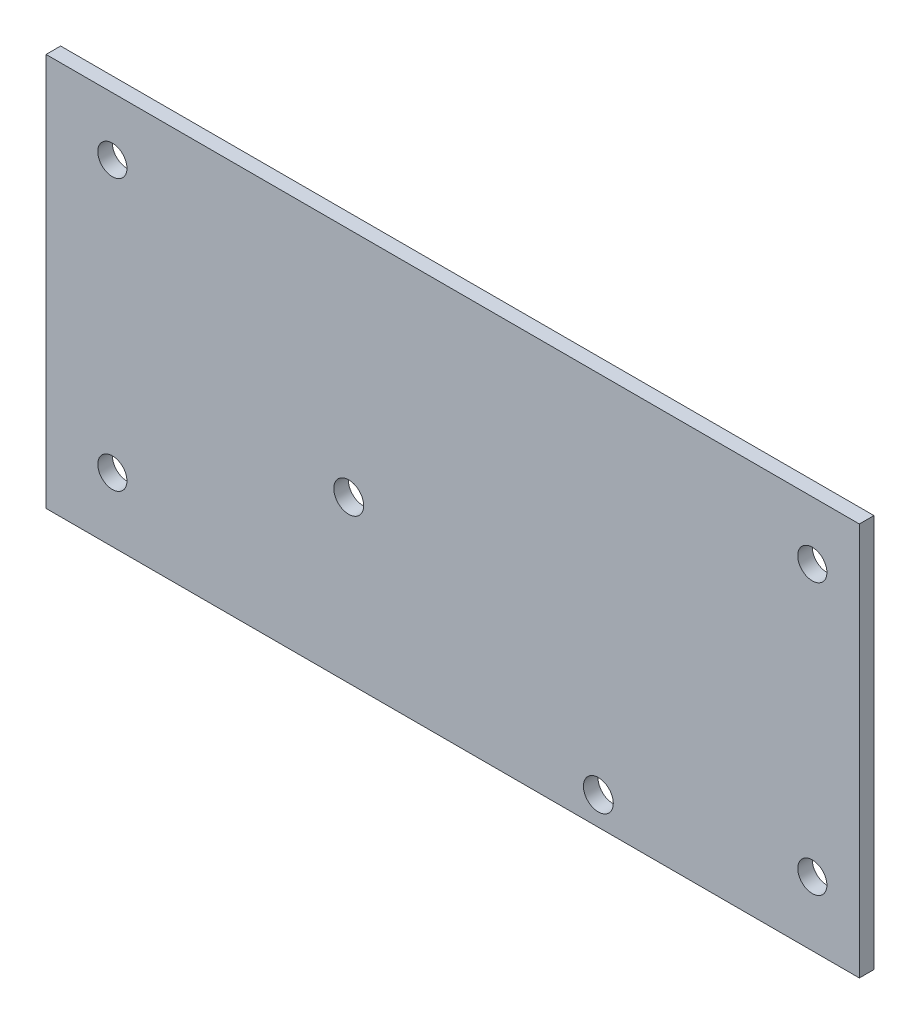
from build123d import *

# Parameters (mm, degrees)
SKETCH1_W           = 177.077705322
SKETCH1_H           = 85.611718561
SKETCH1_R           = 3.175
SKETCH1_R_2         = 3.2512
BOSS_EXTRUDE1_DEPTH = 3.175


with BuildPart() as part:
    # Sketch1 → Boss-Extrude1 (new body)
    with BuildSketch(Plane.XY):
        with Locations((-154.496819091, 264.693002138)):
            Rectangle(SKETCH1_W, SKETCH1_H)
        with Locations((-76.2, 294.821428571)):
            Circle(SKETCH1_R, mode=Mode.SUBTRACT)
        with Locations((-76.2, 235.857142857)):
            Circle(SKETCH1_R, mode=Mode.SUBTRACT)
        with Locations((-228.6, 294.821428571)):
            Circle(SKETCH1_R, mode=Mode.SUBTRACT)
        with Locations((-228.6, 235.857142857)):
            Circle(SKETCH1_R, mode=Mode.SUBTRACT)
        with Locations((-122.783926369, 228.025735167)):
            Circle(SKETCH1_R_2, mode=Mode.SUBTRACT)
        with Locations((-177.139926369, 256.981735167)):
            Circle(SKETCH1_R_2, mode=Mode.SUBTRACT)
    extrude(amount=BOSS_EXTRUDE1_DEPTH)


solid = part.part
